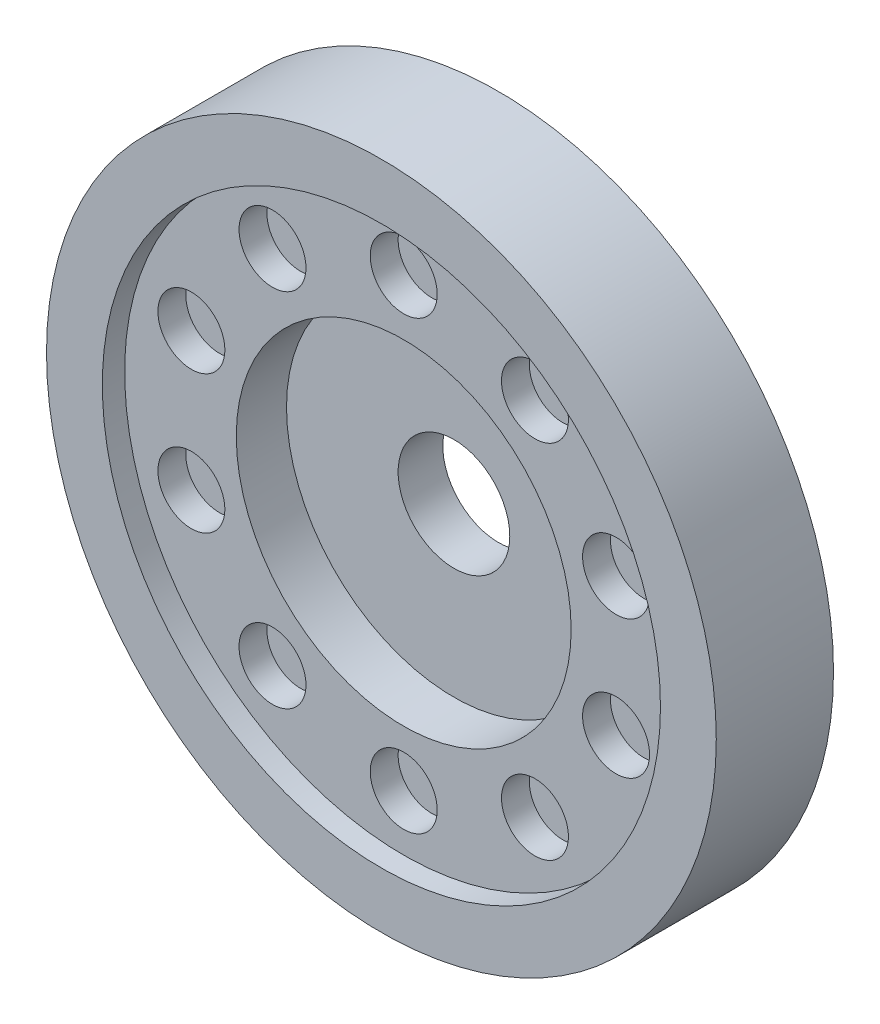
from build123d import *

# Parameters (mm, degrees)
SKETCH1_R           = 381
BOSS_EXTRUDE1_DEPTH = 133.35
SKETCH2_R           = 63.5
CUT_EXTRUDE1_DEPTH  = 556.071367033
SKETCH6_R           = 317.5
CUT_EXTRUDE5_DEPTH  = 25.4
SKETCH7_R           = 190.5
CUT_EXTRUDE6_DEPTH  = 82.55
SKETCH8_R           = 38.1
CUT_EXTRUDE8_DEPTH  = 57.15


with BuildPart() as part:
    # Sketch1 → Boss-Extrude1 (new body)
    with BuildSketch(Plane.XY):
        Circle(SKETCH1_R)
    extrude(amount=BOSS_EXTRUDE1_DEPTH)

    # Sketch2 → Cut-Extrude1 (cut, through all)
    with BuildSketch(Plane.XY.offset(133.35)):
        Circle(SKETCH2_R)
    extrude(amount=-CUT_EXTRUDE1_DEPTH, mode=Mode.SUBTRACT)

    # Sketch6 → Cut-Extrude5 (cut)
    with BuildSketch(Plane.XY.offset(133.35)):
        Circle(SKETCH6_R)
    extrude(amount=-CUT_EXTRUDE5_DEPTH, mode=Mode.SUBTRACT)

    # Sketch7 → Cut-Extrude6 (cut)
    with BuildSketch(Plane.XY.offset(133.35)):
        Circle(SKETCH7_R)
    extrude(amount=-CUT_EXTRUDE6_DEPTH, mode=Mode.SUBTRACT)

    # Sketch8 → Cut-Extrude8 (cut)
    with BuildSketch(Plane.XY.offset(133.35)):
        with Locations((0, 254)):
            Circle(SKETCH8_R)
        with Locations((149.297454082, 205.490316571)):
            Circle(SKETCH8_R)
        with Locations((241.568355139, 78.490316571)):
            Circle(SKETCH8_R)
        with Locations((241.568355139, -78.490316571)):
            Circle(SKETCH8_R)
        with Locations((149.297454082, -205.490316571)):
            Circle(SKETCH8_R)
        with Locations((0, -254)):
            Circle(SKETCH8_R)
        with Locations((-149.297454082, -205.490316571)):
            Circle(SKETCH8_R)
        with Locations((-241.568355139, -78.490316571)):
            Circle(SKETCH8_R)
        with Locations((-241.568355139, 78.490316571)):
            Circle(SKETCH8_R)
        with Locations((-149.297454082, 205.490316571)):
            Circle(SKETCH8_R)
    extrude(amount=-CUT_EXTRUDE8_DEPTH, mode=Mode.SUBTRACT)


solid = part.part
